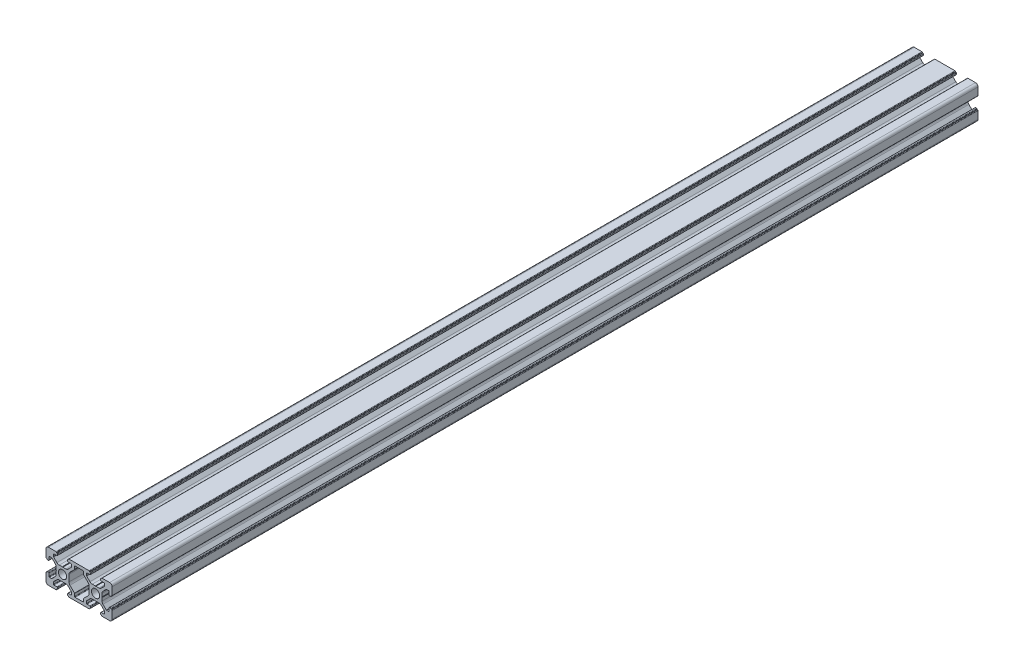
from build123d import *

# Parameters (mm, degrees)
SKETCH_1_R      = 2.5
EXTRUDE_1_DEPTH = 524


with BuildPart() as part:
    # 草图1 → 凸台-拉伸1 (new body)
    with BuildSketch(Plane.XY):
        with BuildLine():
            Line((4.5, -6.68492424), (4.5, -7.9))
            ThreePointArc((4.5, -7.9), (4.587867966, -8.112132034), (4.8, -8.2))
            Line((4.8, -8.2), (6.6, -8.2))
            ThreePointArc((6.6, -8.2), (6.812132034, -8.287867966), (6.9, -8.5))
            Line((6.9, -8.5), (6.9, -9.2))
            ThreePointArc((6.9, -9.2), (6.812132034, -9.412132034), (6.6, -9.5))
            Line((6.6, -9.5), (6.4, -9.5))
            Line((6.4, -9.5), (6.4, -9.7))
            ThreePointArc((6.4, -9.7), (6.312132034, -9.912132034), (6.1, -10))
            Line((6.1, -10), (-6.1, -10))
            ThreePointArc((-6.1, -10), (-6.312132034, -9.912132034), (-6.4, -9.7))
            Line((-6.4, -9.7), (-6.4, -9.5))
            Line((-6.4, -9.5), (-6.6, -9.5))
            ThreePointArc((-6.6, -9.5), (-6.812132034, -9.412132034), (-6.9, -9.2))
            Line((-6.9, -9.2), (-6.9, -8.5))
            ThreePointArc((-6.9, -8.5), (-6.812132034, -8.287867966), (-6.6, -8.2))
            Line((-6.6, -8.2), (-4.8, -8.2))
            ThreePointArc((-4.8, -8.2), (-4.587867966, -8.112132034), (-4.5, -7.9))
            Line((-4.5, -7.9), (-4.5, -6.68492424))
            ThreePointArc((-4.5, -6.68492424), (-4.52283614, -6.570119211), (-4.587867966, -6.472792206))
            Line((-4.587867966, -6.472792206), (-6.574873734, -4.485786438))
            ThreePointArc((-6.574873734, -4.485786438), (-7.223720432, -4.052240935), (-7.989087297, -3.9))
            Line((-7.989087297, -3.9), (-9.8, -3.9))
            Line((-9.8, -3.9), (-10, -3.7))
            Line((-10, -3.7), (-10.2, -3.9))
            Line((-10.2, -3.9), (-12.010912703, -3.9))
            ThreePointArc((-12.010912703, -3.9), (-12.776279568, -4.052240935), (-13.425126266, -4.485786438))
            Line((-13.425126266, -4.485786438), (-15.412132034, -6.472792206))
            ThreePointArc((-15.412132034, -6.472792206), (-15.47716386, -6.570119211), (-15.5, -6.68492424))
            Line((-15.5, -6.68492424), (-15.5, -7.9))
            ThreePointArc((-15.5, -7.9), (-15.412132034, -8.112132034), (-15.2, -8.2))
            Line((-15.2, -8.2), (-13.4, -8.2))
            ThreePointArc((-13.4, -8.2), (-13.187867965, -8.287867966), (-13.1, -8.5))
            Line((-13.1, -8.5), (-13.1, -9.2))
            ThreePointArc((-13.1, -9.2), (-13.187867966, -9.412132034), (-13.4, -9.5))
            Line((-13.4, -9.5), (-13.6, -9.5))
            Line((-13.6, -9.5), (-13.6, -9.7))
            ThreePointArc((-13.6, -9.7), (-13.687867966, -9.912132034), (-13.9, -10))
            Line((-13.9, -10), (-18.5, -10))
            ThreePointArc((-18.5, -10), (-19.560660172, -9.560660172), (-20, -8.5))
            Line((-20, -8.5), (-20, -3.9))
            ThreePointArc((-20, -3.9), (-19.912132034, -3.687867966), (-19.7, -3.6))
            Line((-19.7, -3.6), (-19.5, -3.6))
            Line((-19.5, -3.6), (-19.5, -3.4))
            ThreePointArc((-19.5, -3.4), (-19.412132034, -3.187867966), (-19.2, -3.1))
            Line((-19.2, -3.1), (-18.5, -3.1))
            ThreePointArc((-18.5, -3.1), (-18.287867965, -3.187867966), (-18.2, -3.4))
            Line((-18.2, -3.4), (-18.2, -5.2))
            ThreePointArc((-18.2, -5.2), (-18.112132034, -5.412132034), (-17.9, -5.5))
            Line((-17.9, -5.5), (-16.68492424, -5.5))
            ThreePointArc((-16.68492424, -5.5), (-16.570119211, -5.47716386), (-16.472792206, -5.412132034))
            Line((-16.472792206, -5.412132034), (-14.485786437, -3.425126266))
            ThreePointArc((-14.485786437, -3.425126266), (-14.052240935, -2.776279568), (-13.9, -2.010912703))
            Line((-13.9, -2.010912703), (-13.9, -0.2))
            Line((-13.9, -0.2), (-13.7, 0))
            Line((-13.7, 0), (-13.9, 0.2))
            Line((-13.9, 0.2), (-13.9, 2.010912703))
            ThreePointArc((-13.9, 2.010912703), (-14.052240935, 2.776279568), (-14.485786437, 3.425126266))
            Line((-14.485786437, 3.425126266), (-16.472792206, 5.412132034))
            ThreePointArc((-16.472792206, 5.412132034), (-16.570119211, 5.47716386), (-16.68492424, 5.5))
            Line((-16.68492424, 5.5), (-17.9, 5.5))
            ThreePointArc((-17.9, 5.5), (-18.112132034, 5.412132034), (-18.2, 5.2))
            Line((-18.2, 5.2), (-18.2, 3.4))
            ThreePointArc((-18.2, 3.4), (-18.287867965, 3.187867966), (-18.5, 3.1))
            Line((-18.5, 3.1), (-19.2, 3.1))
            ThreePointArc((-19.2, 3.1), (-19.412132034, 3.187867966), (-19.5, 3.4))
            Line((-19.5, 3.4), (-19.5, 3.6))
            Line((-19.5, 3.6), (-19.7, 3.6))
            ThreePointArc((-19.7, 3.6), (-19.912132034, 3.687867966), (-20, 3.9))
            Line((-20, 3.9), (-20, 8.5))
            ThreePointArc((-20, 8.5), (-19.560660172, 9.560660172), (-18.5, 10))
            Line((-18.5, 10), (-13.9, 10))
            ThreePointArc((-13.9, 10), (-13.687867966, 9.912132034), (-13.6, 9.7))
            Line((-13.6, 9.7), (-13.6, 9.5))
            Line((-13.6, 9.5), (-13.4, 9.5))
            ThreePointArc((-13.4, 9.5), (-13.187867966, 9.412132034), (-13.1, 9.2))
            Line((-13.1, 9.2), (-13.1, 8.5))
            ThreePointArc((-13.1, 8.5), (-13.187867965, 8.287867966), (-13.4, 8.2))
            Line((-13.4, 8.2), (-15.2, 8.2))
            ThreePointArc((-15.2, 8.2), (-15.412132034, 8.112132034), (-15.5, 7.9))
            Line((-15.5, 7.9), (-15.5, 6.68492424))
            ThreePointArc((-15.5, 6.68492424), (-15.47716386, 6.570119211), (-15.412132034, 6.472792206))
            Line((-15.412132034, 6.472792206), (-13.425126266, 4.485786438))
            ThreePointArc((-13.425126266, 4.485786438), (-12.776279568, 4.052240935), (-12.010912703, 3.9))
            Line((-12.010912703, 3.9), (-10.2, 3.9))
            Line((-10.2, 3.9), (-10, 3.7))
            Line((-10, 3.7), (-9.8, 3.9))
            Line((-9.8, 3.9), (-7.989087297, 3.9))
            ThreePointArc((-7.989087297, 3.9), (-7.223720432, 4.052240935), (-6.574873734, 4.485786438))
            Line((-6.574873734, 4.485786438), (-4.587867966, 6.472792206))
            ThreePointArc((-4.587867966, 6.472792206), (-4.52283614, 6.570119211), (-4.5, 6.68492424))
            Line((-4.5, 6.68492424), (-4.5, 7.9))
            ThreePointArc((-4.5, 7.9), (-4.587867966, 8.112132034), (-4.8, 8.2))
            Line((-4.8, 8.2), (-6.6, 8.2))
            ThreePointArc((-6.6, 8.2), (-6.812132034, 8.287867966), (-6.9, 8.5))
            Line((-6.9, 8.5), (-6.9, 9.2))
            ThreePointArc((-6.9, 9.2), (-6.812132034, 9.412132034), (-6.6, 9.5))
            Line((-6.6, 9.5), (-6.4, 9.5))
            Line((-6.4, 9.5), (-6.4, 9.7))
            ThreePointArc((-6.4, 9.7), (-6.312132034, 9.912132034), (-6.1, 10))
            Line((-6.1, 10), (6.1, 10))
            ThreePointArc((6.1, 10), (6.312132034, 9.912132034), (6.4, 9.7))
            Line((6.4, 9.7), (6.4, 9.5))
            Line((6.4, 9.5), (6.6, 9.5))
            ThreePointArc((6.6, 9.5), (6.812132034, 9.412132034), (6.9, 9.2))
            Line((6.9, 9.2), (6.9, 8.5))
            ThreePointArc((6.9, 8.5), (6.812132034, 8.287867966), (6.6, 8.2))
            Line((6.6, 8.2), (4.8, 8.2))
            ThreePointArc((4.8, 8.2), (4.587867966, 8.112132034), (4.5, 7.9))
            Line((4.5, 7.9), (4.5, 6.68492424))
            ThreePointArc((4.5, 6.68492424), (4.52283614, 6.570119211), (4.587867966, 6.472792206))
            Line((4.587867966, 6.472792206), (6.574873734, 4.485786438))
            ThreePointArc((6.574873734, 4.485786438), (7.223720432, 4.052240935), (7.989087297, 3.9))
            Line((7.989087297, 3.9), (9.8, 3.9))
            Line((9.8, 3.9), (10, 3.7))
            Line((10, 3.7), (10.2, 3.9))
            Line((10.2, 3.9), (12.010912703, 3.9))
            ThreePointArc((12.010912703, 3.9), (12.776279568, 4.052240935), (13.425126266, 4.485786438))
            Line((13.425126266, 4.485786438), (15.412132034, 6.472792206))
            ThreePointArc((15.412132034, 6.472792206), (15.47716386, 6.570119211), (15.5, 6.68492424))
            Line((15.5, 6.68492424), (15.5, 7.9))
            ThreePointArc((15.5, 7.9), (15.412132034, 8.112132034), (15.2, 8.2))
            Line((15.2, 8.2), (13.4, 8.2))
            ThreePointArc((13.4, 8.2), (13.187867965, 8.287867966), (13.1, 8.5))
            Line((13.1, 8.5), (13.1, 9.2))
            ThreePointArc((13.1, 9.2), (13.187867966, 9.412132034), (13.4, 9.5))
            Line((13.4, 9.5), (13.6, 9.5))
            Line((13.6, 9.5), (13.6, 9.7))
            ThreePointArc((13.6, 9.7), (13.687867966, 9.912132034), (13.9, 10))
            Line((13.9, 10), (18.5, 10))
            ThreePointArc((18.5, 10), (19.560660172, 9.560660172), (20, 8.5))
            Line((20, 8.5), (20, 3.9))
            ThreePointArc((20, 3.9), (19.912132034, 3.687867966), (19.7, 3.6))
            Line((19.7, 3.6), (19.5, 3.6))
            Line((19.5, 3.6), (19.5, 3.4))
            ThreePointArc((19.5, 3.4), (19.412132034, 3.187867966), (19.2, 3.1))
            Line((19.2, 3.1), (18.5, 3.1))
            ThreePointArc((18.5, 3.1), (18.287867965, 3.187867966), (18.2, 3.4))
            Line((18.2, 3.4), (18.2, 5.2))
            ThreePointArc((18.2, 5.2), (18.112132034, 5.412132034), (17.9, 5.5))
            Line((17.9, 5.5), (16.68492424, 5.5))
            ThreePointArc((16.68492424, 5.5), (16.570119211, 5.47716386), (16.472792206, 5.412132034))
            Line((16.472792206, 5.412132034), (14.485786438, 3.425126266))
            ThreePointArc((14.485786438, 3.425126266), (14.052240935, 2.776279568), (13.9, 2.010912703))
            Line((13.9, 2.010912703), (13.9, 0.2))
            Line((13.9, 0.2), (13.7, 0))
            Line((13.7, 0), (13.9, -0.2))
            Line((13.9, -0.2), (13.9, -2.010912703))
            ThreePointArc((13.9, -2.010912703), (14.052240935, -2.776279568), (14.485786438, -3.425126266))
            Line((14.485786438, -3.425126266), (16.472792206, -5.412132034))
            ThreePointArc((16.472792206, -5.412132034), (16.570119211, -5.47716386), (16.68492424, -5.5))
            Line((16.68492424, -5.5), (17.9, -5.5))
            ThreePointArc((17.9, -5.5), (18.112132034, -5.412132034), (18.2, -5.2))
            Line((18.2, -5.2), (18.2, -3.4))
            ThreePointArc((18.2, -3.4), (18.287867965, -3.187867966), (18.5, -3.1))
            Line((18.5, -3.1), (19.2, -3.1))
            ThreePointArc((19.2, -3.1), (19.412132034, -3.187867966), (19.5, -3.4))
            Line((19.5, -3.4), (19.5, -3.6))
            Line((19.5, -3.6), (19.7, -3.6))
            ThreePointArc((19.7, -3.6), (19.912132034, -3.687867966), (20, -3.9))
            Line((20, -3.9), (20, -8.5))
            ThreePointArc((20, -8.5), (19.560660172, -9.560660172), (18.5, -10))
            Line((18.5, -10), (13.9, -10))
            ThreePointArc((13.9, -10), (13.687867966, -9.912132034), (13.6, -9.7))
            Line((13.6, -9.7), (13.6, -9.5))
            Line((13.6, -9.5), (13.4, -9.5))
            ThreePointArc((13.4, -9.5), (13.187867966, -9.412132034), (13.1, -9.2))
            Line((13.1, -9.2), (13.1, -8.5))
            ThreePointArc((13.1, -8.5), (13.187867965, -8.287867966), (13.4, -8.2))
            Line((13.4, -8.2), (15.2, -8.2))
            ThreePointArc((15.2, -8.2), (15.412132034, -8.112132034), (15.5, -7.9))
            Line((15.5, -7.9), (15.5, -6.68492424))
            ThreePointArc((15.5, -6.68492424), (15.47716386, -6.570119211), (15.412132034, -6.472792206))
            Line((15.412132034, -6.472792206), (13.425126266, -4.485786438))
            ThreePointArc((13.425126266, -4.485786438), (12.776279568, -4.052240935), (12.010912703, -3.9))
            Line((12.010912703, -3.9), (10.2, -3.9))
            Line((10.2, -3.9), (10, -3.7))
            Line((10, -3.7), (9.8, -3.9))
            Line((9.8, -3.9), (7.989087297, -3.9))
            ThreePointArc((7.989087297, -3.9), (7.223720432, -4.052240935), (6.574873734, -4.485786438))
            Line((6.574873734, -4.485786438), (4.587867966, -6.472792206))
            ThreePointArc((4.587867966, -6.472792206), (4.52283614, -6.570119211), (4.5, -6.68492424))
        make_face()
        with Locations((10, 0)):
            Circle(SKETCH_1_R, mode=Mode.SUBTRACT)
        with Locations((-10, 0)):
            Circle(SKETCH_1_R, mode=Mode.SUBTRACT)
        with BuildLine():
            Line((-2.7, -6.363603897), (-2.7, -7.9))
            ThreePointArc((-2.7, -7.9), (-2.612132034, -8.112132034), (-2.4, -8.2))
            Line((-2.4, -8.2), (2.4, -8.2))
            ThreePointArc((2.4, -8.2), (2.612132034, -8.112132034), (2.7, -7.9))
            Line((2.7, -7.9), (2.7, -6.363603897))
            ThreePointArc((2.7, -6.363603897), (2.72283614, -6.248798867), (2.787867966, -6.151471863))
            Line((2.787867966, -6.151471863), (5.514213562, -3.425126266))
            ThreePointArc((5.514213562, -3.425126266), (5.947759065, -2.776279568), (6.1, -2.010912703))
            Line((6.1, -2.010912703), (6.1, 0))
            Line((6.1, 0), (6.1, 2.010912703))
            ThreePointArc((6.1, 2.010912703), (5.947759065, 2.776279568), (5.514213562, 3.425126266))
            Line((5.514213562, 3.425126266), (2.787867966, 6.151471863))
            ThreePointArc((2.787867966, 6.151471863), (2.72283614, 6.248798867), (2.7, 6.363603897))
            Line((2.7, 6.363603897), (2.7, 7.9))
            ThreePointArc((2.7, 7.9), (2.612132034, 8.112132034), (2.4, 8.2))
            Line((2.4, 8.2), (-2.4, 8.2))
            ThreePointArc((-2.4, 8.2), (-2.612132034, 8.112132034), (-2.7, 7.9))
            Line((-2.7, 7.9), (-2.7, 6.363603897))
            ThreePointArc((-2.7, 6.363603897), (-2.72283614, 6.248798867), (-2.787867966, 6.151471863))
            Line((-2.787867966, 6.151471863), (-5.514213562, 3.425126266))
            ThreePointArc((-5.514213562, 3.425126266), (-5.947759065, 2.776279568), (-6.1, 2.010912703))
            Line((-6.1, 2.010912703), (-6.1, 0))
            Line((-6.1, 0), (-6.1, -2.010912703))
            ThreePointArc((-6.1, -2.010912703), (-5.947759065, -2.776279568), (-5.514213562, -3.425126266))
            Line((-5.514213562, -3.425126266), (-2.787867966, -6.151471863))
            ThreePointArc((-2.787867966, -6.151471863), (-2.72283614, -6.248798867), (-2.7, -6.363603897))
        make_face(mode=Mode.SUBTRACT)
    extrude(amount=EXTRUDE_1_DEPTH)


solid = part.part
